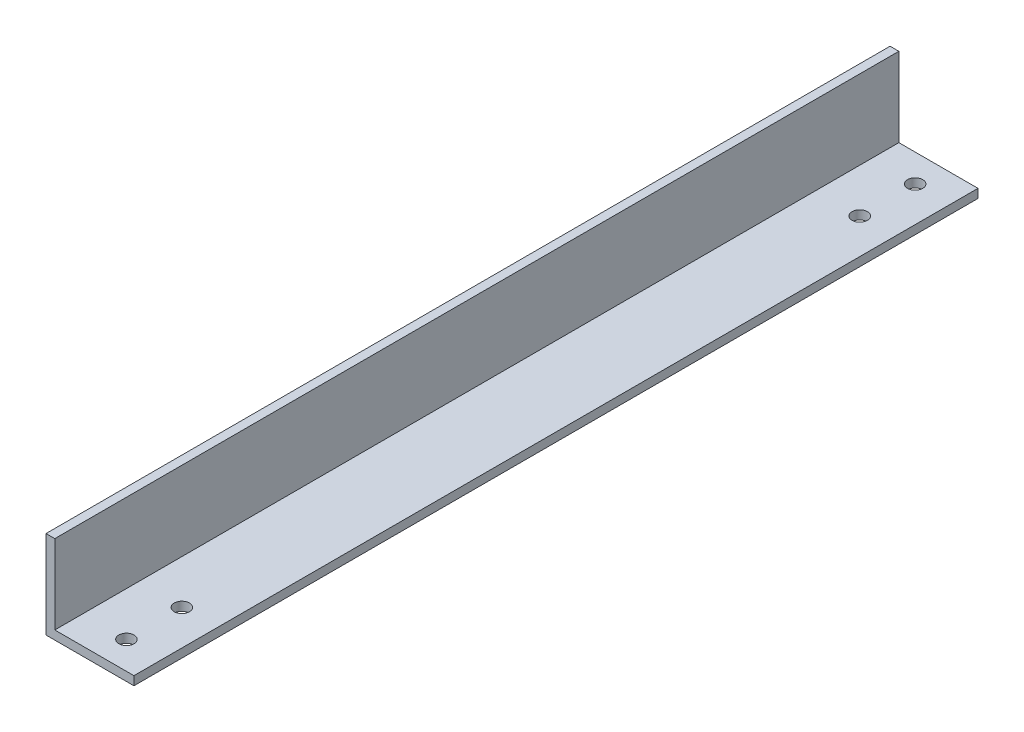
from build123d import *

# Parameters (mm, degrees)
BOSS_EXTRUDE1_DEPTH      = 304.8
M5_CLEARANCE_HOLE1_D     = 5.5
M5_CLEARANCE_HOLE1_DEPTH = 25.4
M5_CLEARANCE_HOLE1_TIP   = 1.652366702


with BuildPart() as part:
    # Sketch1 → Boss-Extrude1 (new body)
    with BuildSketch(Plane.XY):
        Polygon((0, 0), (0, 31.75), (3.175, 31.75), (3.175, 3.175), (31.75, 3.175), (31.75, 0), align=None)
    extrude(amount=BOSS_EXTRUDE1_DEPTH)

    # M5 Clearance Hole1
    with Locations(Plane(origin=(0, 3.175, 0), x_dir=(1, 0, 0), z_dir=(0, 1, 0))):
        with Locations((19.05, -10), (19.05, -294.8), (19.05, -30), (19.05, -274.8)):
            Hole(M5_CLEARANCE_HOLE1_D / 2, depth=M5_CLEARANCE_HOLE1_DEPTH)
            with Locations((0, 0, -(M5_CLEARANCE_HOLE1_DEPTH + M5_CLEARANCE_HOLE1_TIP / 2))):  # 118° drill point
                Cone(0, M5_CLEARANCE_HOLE1_D / 2, M5_CLEARANCE_HOLE1_TIP, mode=Mode.SUBTRACT)


solid = part.part
